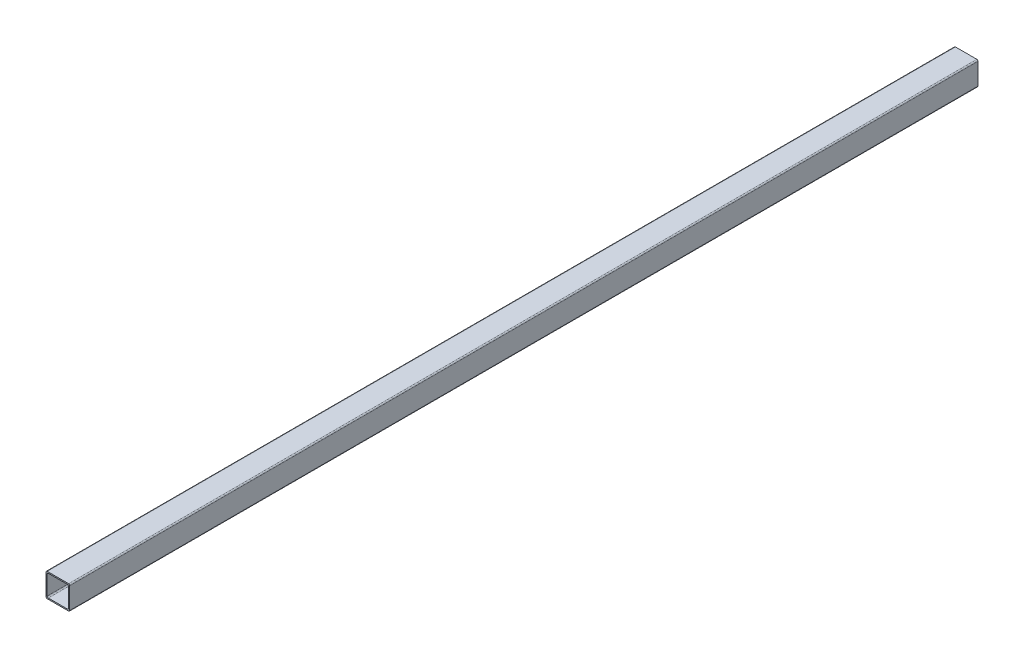
from build123d import *

# Parameters (mm, degrees)
EXTRUDE_1_DEPTH = 1530


with BuildPart() as part:
    # Эскиз1 → Бобышка-Вытянуть1 (new body)
    with BuildSketch(Plane.XY):
        with BuildLine():
            Line((-18, 20), (18, 20))
            ThreePointArc((18, 20), (19.414213562, 19.414213562), (20, 18))
            Line((20, 18), (20, -18))
            ThreePointArc((20, -18), (19.414213562, -19.414213562), (18, -20))
            Line((18, -20), (-18, -20))
            ThreePointArc((-18, -20), (-19.414213562, -19.414213562), (-20, -18))
            Line((-20, -18), (-20, 18))
            ThreePointArc((-20, 18), (-19.414213562, 19.414213562), (-18, 20))
        make_face()
        with BuildLine():
            Line((16, -18), (-16, -18))
            ThreePointArc((-16, -18), (-17.414213562, -17.414213562), (-18, -16))
            Line((-18, -16), (-18, 16))
            ThreePointArc((-18, 16), (-17.414213562, 17.414213562), (-16, 18))
            Line((-16, 18), (16, 18))
            ThreePointArc((16, 18), (17.414213562, 17.414213562), (18, 16))
            Line((18, 16), (18, -16))
            ThreePointArc((18, -16), (17.414213562, -17.414213562), (16, -18))
        make_face(mode=Mode.SUBTRACT)
    extrude(amount=EXTRUDE_1_DEPTH)


solid = part.part
